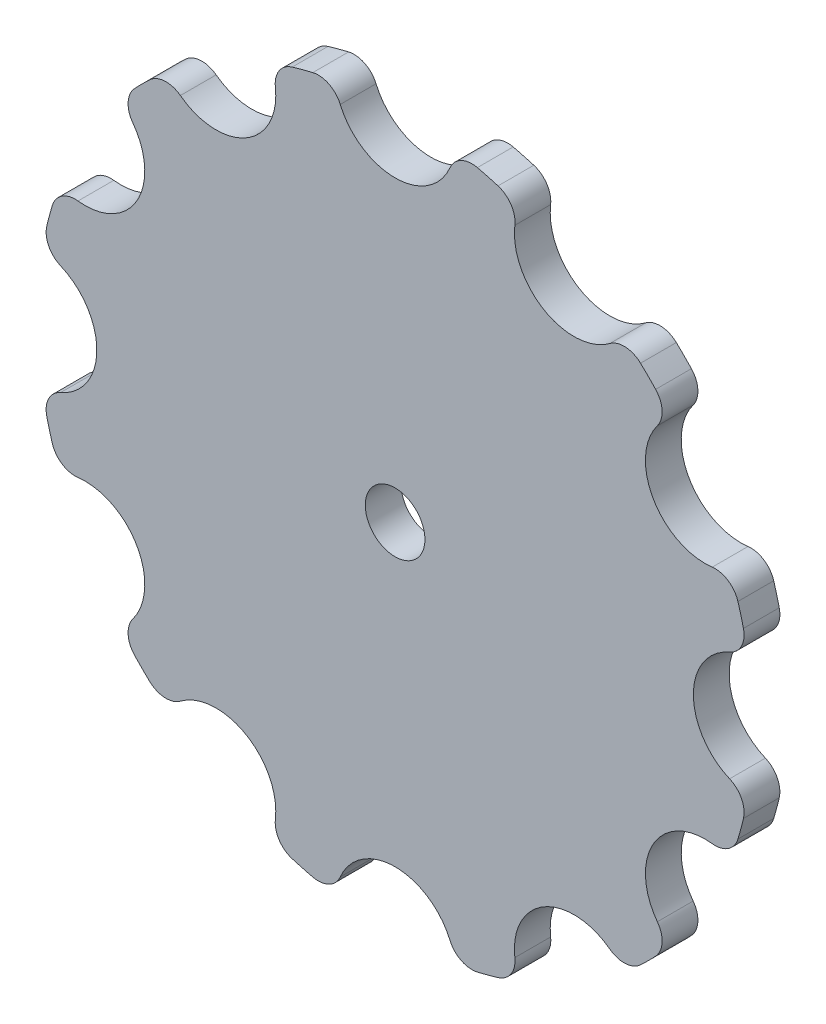
from build123d import *

# Parameters (mm, degrees)
BOSS_EXTRUDE1_DEPTH = 3
FILLET1_R           = 2
FILLET2_R           = 2
SKETCH2_R           = 2.5
CUT_EXTRUDE1_DEPTH  = 10


with BuildPart() as part:
    # Sketch1 → Boss-Extrude1 (new body)
    with BuildSketch(Plane.XY):
        with BuildLine():
            ThreePointArc((29.583333333, -4.982608643), (25, 0), (29.583333333, 4.982608643))
            ThreePointArc((29.583333333, 4.982608643), (28.977774789, 7.764571353), (28.111222517, 10.476601005))
            ThreePointArc((28.111222517, 10.476601005), (21.650635095, 12.5), (23.128613874, 19.106732329))
            ThreePointArc((23.128613874, 19.106732329), (21.213203436, 21.213203436), (19.106732329, 23.128613874))
            ThreePointArc((19.106732329, 23.128613874), (12.5, 21.650635095), (10.476601005, 28.111222517))
            ThreePointArc((10.476601005, 28.111222517), (7.764571353, 28.977774789), (4.982608643, 29.583333333))
            ThreePointArc((4.982608643, 29.583333333), (0, 25), (-4.982608643, 29.583333333))
            ThreePointArc((-4.982608643, 29.583333333), (-7.764571353, 28.977774789), (-10.476601005, 28.111222517))
            ThreePointArc((-10.476601005, 28.111222517), (-10.120604803, 27.072321783), (-10, 25.980762114))
            ThreePointArc((-10, 25.980762114), (-13.505620805, 21.209302083), (-19.106732329, 23.128613874))
            ThreePointArc((-19.106732329, 23.128613874), (-21.213203436, 21.213203436), (-23.128613874, 19.106732329))
            ThreePointArc((-23.128613874, 19.106732329), (-21.550144707, 17.317246081), (-20.980762114, 15))
            ThreePointArc((-20.980762114, 15), (-23.302357926, 10.777897324), (-28.111222517, 10.476601005))
            ThreePointArc((-28.111222517, 10.476601005), (-28.977774789, 7.764571353), (-29.583333333, 4.982608643))
            ThreePointArc((-29.583333333, 4.982608643), (-26.320099639, 3.385016002), (-25, 0))
            ThreePointArc((-25, 0), (-26.320099639, -3.385016002), (-29.583333333, -4.982608643))
            ThreePointArc((-29.583333333, -4.982608643), (-28.977774789, -7.764571353), (-28.111222517, -10.476601005))
            ThreePointArc((-28.111222517, -10.476601005), (-23.302357926, -10.777897324), (-20.980762114, -15))
            ThreePointArc((-20.980762114, -15), (-21.550144707, -17.317246081), (-23.128613874, -19.106732329))
            ThreePointArc((-23.128613874, -19.106732329), (-21.213203436, -21.213203436), (-19.106732329, -23.128613874))
            ThreePointArc((-19.106732329, -23.128613874), (-13.505620805, -21.209302083), (-10, -25.980762114))
            ThreePointArc((-10, -25.980762114), (-10.120604803, -27.072321783), (-10.476601005, -28.111222517))
            ThreePointArc((-10.476601005, -28.111222517), (-7.764571353, -28.977774789), (-4.982608643, -29.583333333))
            ThreePointArc((-4.982608643, -29.583333333), (0, -25), (4.982608643, -29.583333333))
            ThreePointArc((4.982608643, -29.583333333), (7.764571353, -28.977774789), (10.476601005, -28.111222517))
            ThreePointArc((10.476601005, -28.111222517), (12.5, -21.650635095), (19.106732329, -23.128613874))
            ThreePointArc((19.106732329, -23.128613874), (21.213203436, -21.213203436), (23.128613874, -19.106732329))
            ThreePointArc((23.128613874, -19.106732329), (21.650635095, -12.5), (28.111222517, -10.476601005))
            ThreePointArc((28.111222517, -10.476601005), (28.977774789, -7.764571353), (29.583333333, -4.982608643))
        make_face()
    extrude(amount=BOSS_EXTRUDE1_DEPTH)

    # Fillet1
    fillet1_edges = [part.edges().sort_by_distance(p)[0] for p in [
        (-10.476601005, 28.111222517, 1.5),
        (-4.982608643, 29.583333333, 1.5),
        (-23.128613874, 19.106732329, 1.5),
        (-19.106732329, 23.128613874, 1.5),
    ]]
    fillet(fillet1_edges, radius=FILLET1_R)

    # Fillet2
    fillet2_edges = [part.edges().sort_by_distance(p)[0] for p in [
        (4.982608643, 29.583333333, 1.5),
        (10.476601005, 28.111222517, 1.5),
        (19.106732329, 23.128613874, 1.5),
        (23.128613874, 19.106732329, 1.5),
        (28.111222517, 10.476601005, 1.5),
        (29.583333333, 4.982608643, 1.5),
        (29.583333333, -4.982608643, 1.5),
        (28.111222517, -10.476601005, 1.5),
        (23.128613874, -19.106732329, 1.5),
        (19.106732329, -23.128613874, 1.5),
        (10.476601005, -28.111222517, 1.5),
        (4.982608643, -29.583333333, 1.5),
        (-4.982608643, -29.583333333, 1.5),
        (-10.476601005, -28.111222517, 1.5),
        (-19.106732329, -23.128613874, 1.5),
        (-23.128613874, -19.106732329, 1.5),
        (-28.111222517, -10.476601005, 1.5),
        (-29.583333333, -4.982608643, 1.5),
        (-29.583333333, 4.982608643, 1.5),
        (-28.111222517, 10.476601005, 1.5),
    ]]
    fillet(fillet2_edges, radius=FILLET2_R)

    # Sketch2 → Cut-Extrude1 (cut)
    with BuildSketch(Plane(origin=(0, 0, 0), x_dir=(-1, 0, 0), z_dir=(0, 0, -1))):
        Circle(SKETCH2_R)
    extrude(amount=-CUT_EXTRUDE1_DEPTH, mode=Mode.SUBTRACT)


solid = part.part
